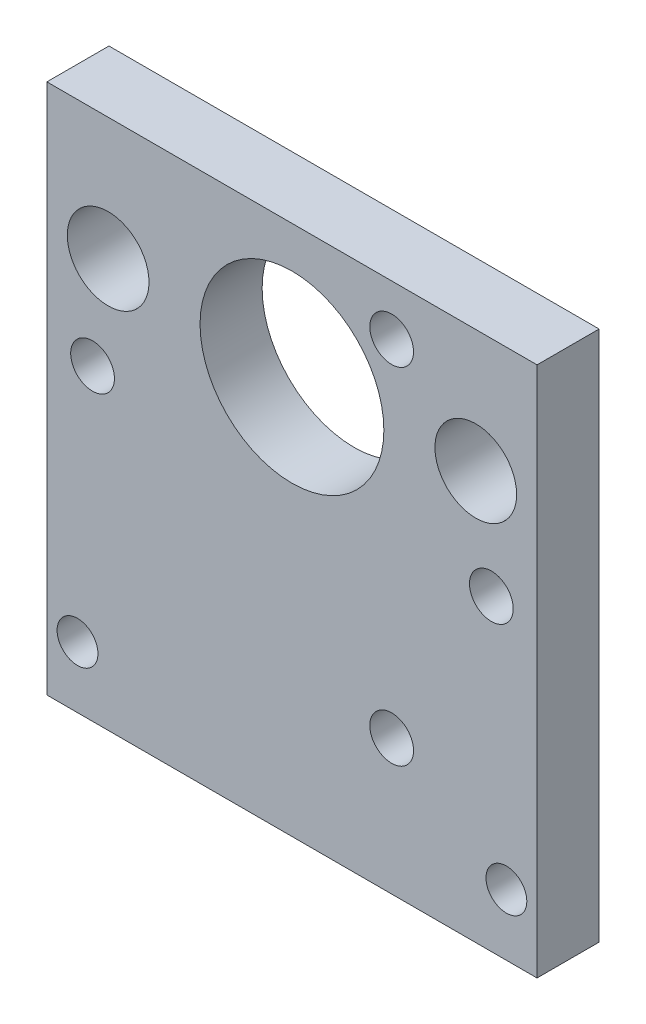
from build123d import *

# Parameters (mm, degrees)
SKETCH1_W                           = 38.1
SKETCH1_H                           = 41.275
BOSS_EXTRUDE1_DEPTH                 = 4.826
SKETCH2_R                           = 7.14375
CUT_EXTRUDE1_DEPTH                  = 29.497353952
F_3_4_3_4_DIAMETER_HOLE1_D          = 3.4
F_1_4_0_25_DIAMETER_HOLE1_D         = 6.35
F_1_8_0_125_CLEARANCE_DOWEL_HOLE1_D = 3.175


with BuildPart() as part:
    # Sketch1 → Boss-Extrude1 (new body)
    with BuildSketch(Plane.XY):
        Rectangle(SKETCH1_W, SKETCH1_H)
    extrude(amount=BOSS_EXTRUDE1_DEPTH)

    # Sketch2 → Cut-Extrude1 (cut, through all)
    with BuildSketch(Plane.XY.offset(4.826)):
        with Locations((0, 10.287)):
            Circle(SKETCH2_R)
    extrude(amount=-CUT_EXTRUDE1_DEPTH, mode=Mode.SUBTRACT)

    # Ø3.4 (3.4) Diameter Hole1 (through all)
    with Locations(Plane.XY.offset(4.826)):
        with Locations((-15.5, 3.287), (7.75, 16.710393759), (15.5, 3.287), (7.75, -10.136393759)):
            Hole(F_3_4_3_4_DIAMETER_HOLE1_D / 2)

    # 1/4 (0.25) Diameter Hole1 (through all)
    with Locations(Plane.XY.offset(4.826)):
        with Locations((-14.2875, 11.1125), (14.2875, 11.1125)):
            Hole(F_1_4_0_25_DIAMETER_HOLE1_D / 2)

    # 1/8 (0.125) Clearance Dowel Hole1 (through all)
    with Locations(Plane.XY.offset(4.826)):
        with Locations((-16.66875, -15.875), (16.66875, -15.875)):
            Hole(F_1_8_0_125_CLEARANCE_DOWEL_HOLE1_D / 2)


solid = part.part
